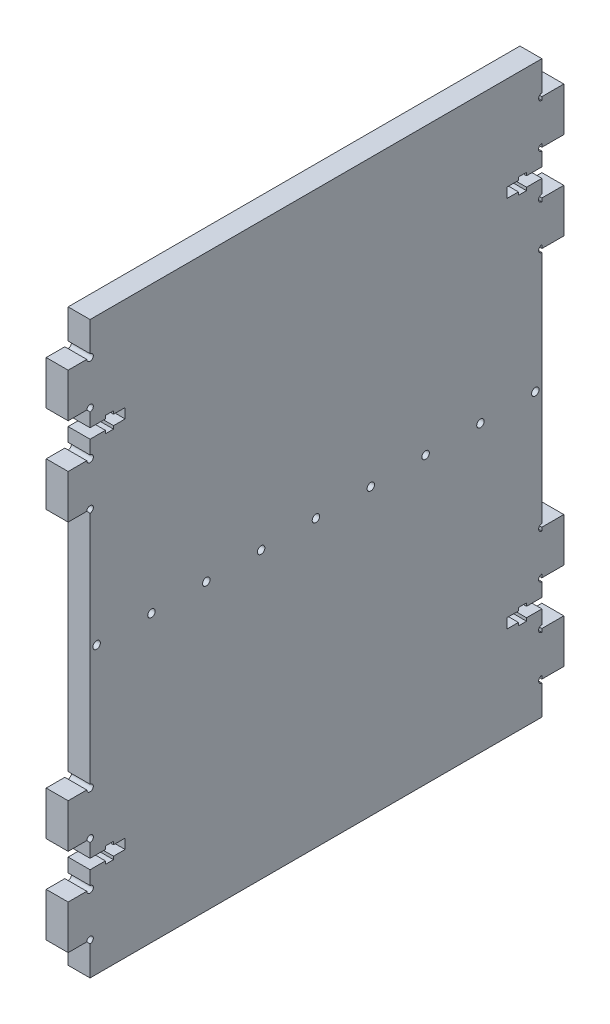
from build123d import *

# Parameters (mm, degrees)
SKETCH1_W                = 206
SKETCH1_H                = 260
EXTRUDE1_DEPTH           = 10
SKETCH3_W                = 10
SKETCH3_H                = 20
EXTRUDE2_DEPTH           = 10
LPATTERN1_COUNT          = 2
LPATTERN1_PITCH          = 196
LPATTERN1_COUNT_DIR2     = 2
LPATTERN1_PITCH_DIR2     = 170
EXTRUDE4_DEPTH           = 10
LPATTERN2_COUNT          = 2
LPATTERN2_PITCH          = 170
LPATTERN2_COPY_1_DEPTH   = 10
EXTRUDE5_DEPTH           = 10
MIRROR3_COPY_1_DEPTH     = 10
M3_CLEARANCE_HOLE1_D     = 3.4
M3_CLEARANCE_HOLE1_DEPTH = 10
M3_CLEARANCE_HOLE1_TIP   = 1.021463052
MIRROR4_COPY_1_SKETCH_W  = 10
MIRROR4_COPY_1_SKETCH_H  = 20
MIRROR4_COPY_1_DEPTH     = 10


with BuildPart() as part:
    # Sketch1 → Extrude1 (new body)
    with BuildSketch(Plane(origin=(0, 0, 0), x_dir=(0, 0, -1), z_dir=(1, 0, 0))):
        Rectangle(SKETCH1_W, SKETCH1_H)
    extrude(amount=EXTRUDE1_DEPTH)

    # Sketch3 → Extrude2 (add)
    with BuildSketch(Plane(origin=(10, 0, 0), x_dir=(0, 0, -1), z_dir=(1, 0, 0))):
        with Locations((-108, -105)):
            Rectangle(SKETCH3_W, SKETCH3_H)
        with Locations((-108, -65)):
            Rectangle(SKETCH3_W, SKETCH3_H)
    extrude2 = extrude(amount=-EXTRUDE2_DEPTH)

    # LPattern1: Extrude2 2 × 2, 2 skipped
    with Locations(*[(i * LPATTERN1_PITCH, j * LPATTERN1_PITCH_DIR2, 0) for i in range(LPATTERN1_COUNT) for j in range(LPATTERN1_COUNT_DIR2) if (i, j) not in ((0, 0), (1, 0), (1, 1))]):
        add(extrude2)

    # Sketch5 → Extrude4 (cut)
    with BuildSketch(Plane(origin=(10, 0, 0), x_dir=(0, 0, -1), z_dir=(1, 0, 0))):
        Polygon((-103, -87.25), (-96, -87.25), (-96, -88.625), (-92.3, -88.625), (-92.3, -87.25), (-87, -87.25), (-87, -82.75), (-92.3, -82.75), (-92.3, -81.375), (-96, -81.375), (-96, -82.75), (-103, -82.75), align=None)
    extrude4 = extrude(amount=-EXTRUDE4_DEPTH, mode=Mode.SUBTRACT)

    # Mirror1: Extrude4 across plane
    add(extrude4.mirror(Plane(origin=(0, 0, 0), x_dir=(1, 0, 0), z_dir=(0, 0, -1))), mode=Mode.SUBTRACT)

    # LPattern2: Extrude4 ×2
    with Locations(*[(0, i * LPATTERN2_PITCH, 0) for i in range(1, LPATTERN2_COUNT)]):
        add(extrude4, mode=Mode.SUBTRACT)

    # LPattern2 copy 1 sketch → LPattern2 copy 1 (cut)
    with BuildSketch(Plane(origin=(10, 170, 0), x_dir=(0, 0, 1), z_dir=(1, 0, 0))):
        Polygon((-103, 87.25), (-96, 87.25), (-96, 88.625), (-92.3, 88.625), (-92.3, 87.25), (-87, 87.25), (-87, 82.75), (-92.3, 82.75), (-92.3, 81.375), (-96, 81.375), (-96, 82.75), (-103, 82.75), align=None)
    extrude(amount=-LPATTERN2_COPY_1_DEPTH, mode=Mode.SUBTRACT)

    # Sketch6 → Extrude5 (cut)
    with BuildSketch(Plane(origin=(10, 0, 0), x_dir=(0, 0, -1), z_dir=(1, 0, 0))):
        with BuildLine():
            Line((-104.5, -115), (-103, -115))
            Line((-103, -115), (-103, -116.5))
            ThreePointArc((-103, -116.5), (-101.939339828, -113.939339828), (-104.5, -115))
        make_face()
        with BuildLine():
            Line((-104.5, -55), (-103, -55))
            Line((-103, -55), (-103, -53.5))
            ThreePointArc((-103, -53.5), (-101.939339828, -56.060660172), (-104.5, -55))
        make_face()
        with BuildLine():
            Line((-104.5, -95), (-103, -95))
            Line((-103, -95), (-103, -93.5))
            ThreePointArc((-103, -93.5), (-101.939339828, -96.060660172), (-104.5, -95))
        make_face()
        with BuildLine():
            Line((-104.5, -75), (-103, -75))
            Line((-103, -75), (-103, -76.5))
            ThreePointArc((-103, -76.5), (-101.939339828, -73.939339828), (-104.5, -75))
        make_face()
    extrude5 = extrude(amount=-EXTRUDE5_DEPTH, mode=Mode.SUBTRACT)

    # Mirror2: Extrude5 across plane
    add(extrude5.mirror(Plane(origin=(0, 0, 0), x_dir=(1, 0, 0), z_dir=(0, 0, -1))), mode=Mode.SUBTRACT)

    # Mirror3: Extrude5 across plane
    add(extrude5.mirror(Plane.ZX), mode=Mode.SUBTRACT)

    # Mirror3 copy 1 sketch → Mirror3 copy 1 (cut)
    with BuildSketch(Plane(origin=(10, 0, 0), x_dir=(0, 0, 1), z_dir=(1, 0, 0))):
        with BuildLine():
            Line((-104.5, -115), (-103, -115))
            Line((-103, -115), (-103, -116.5))
            ThreePointArc((-103, -116.5), (-101.939339828, -113.939339828), (-104.5, -115))
        make_face()
        with BuildLine():
            Line((-104.5, -55), (-103, -55))
            Line((-103, -55), (-103, -53.5))
            ThreePointArc((-103, -53.5), (-101.939339828, -56.060660172), (-104.5, -55))
        make_face()
        with BuildLine():
            Line((-104.5, -95), (-103, -95))
            Line((-103, -95), (-103, -93.5))
            ThreePointArc((-103, -93.5), (-101.939339828, -96.060660172), (-104.5, -95))
        make_face()
        with BuildLine():
            Line((-104.5, -75), (-103, -75))
            Line((-103, -75), (-103, -76.5))
            ThreePointArc((-103, -76.5), (-101.939339828, -73.939339828), (-104.5, -75))
        make_face()
    extrude(amount=-MIRROR3_COPY_1_DEPTH, mode=Mode.SUBTRACT)

    # M3 Clearance Hole1
    with Locations(Plane(origin=(10, -130, 293), x_dir=(0, -1, 0), z_dir=(1, 0, 0))):
        with Locations((-130, 368), (-130, 343), (-130, 318), (-130, 293), (-130, 268), (-130, 243), (-130, 218), (-130, 193), (-130, 393)):
            Hole(M3_CLEARANCE_HOLE1_D / 2, depth=M3_CLEARANCE_HOLE1_DEPTH)
            with Locations((0, 0, -(M3_CLEARANCE_HOLE1_DEPTH + M3_CLEARANCE_HOLE1_TIP / 2))):  # 118° drill point
                Cone(0, M3_CLEARANCE_HOLE1_D / 2, M3_CLEARANCE_HOLE1_TIP, mode=Mode.SUBTRACT)

    # Mirror4: Extrude2 across plane
    add(extrude2.mirror(Plane(origin=(0, 0, 0), x_dir=(1, 0, 0), z_dir=(0, 0, -1))))

    # Mirror4 copy 1 sketch → Mirror4 copy 1 (add)
    with BuildSketch(Plane(origin=(10, 170, 0), x_dir=(0, 0, 1), z_dir=(1, 0, 0))):
        with Locations((-108, 105)):
            Rectangle(MIRROR4_COPY_1_SKETCH_W, MIRROR4_COPY_1_SKETCH_H)
        with Locations((-108, 65)):
            Rectangle(MIRROR4_COPY_1_SKETCH_W, MIRROR4_COPY_1_SKETCH_H)
    extrude(amount=-MIRROR4_COPY_1_DEPTH)


solid = part.part
